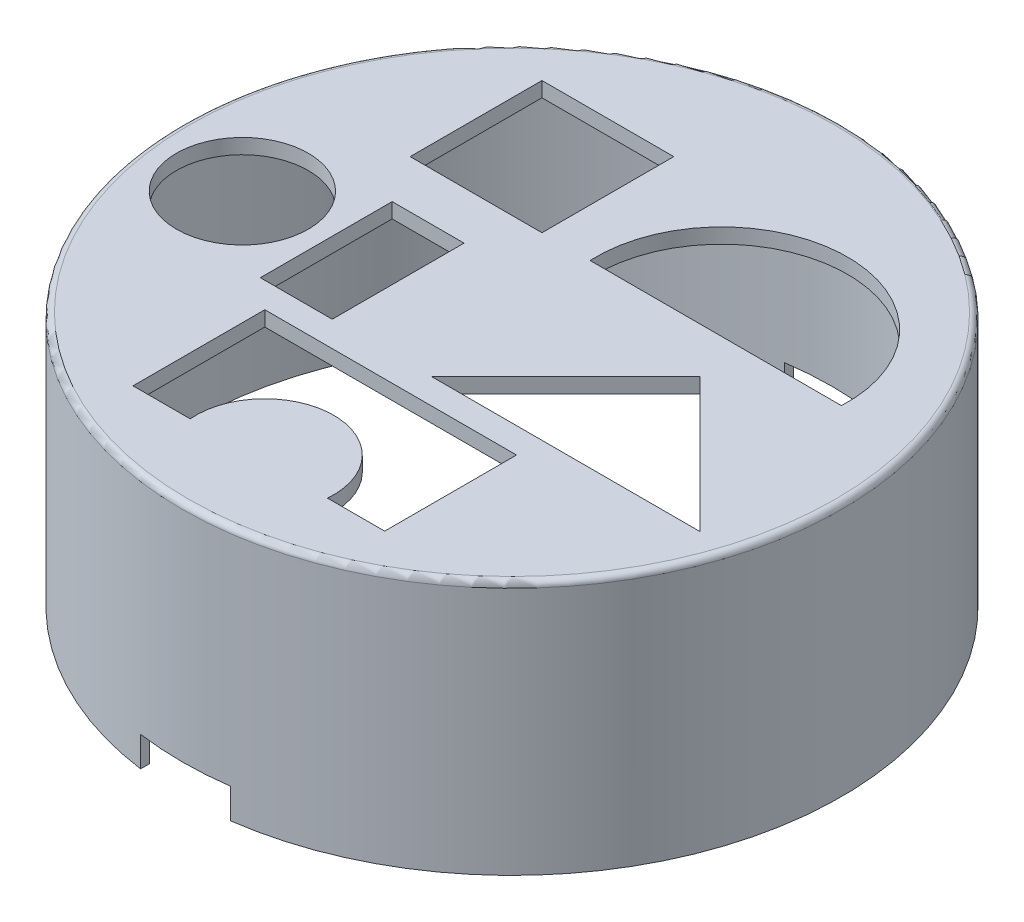
from build123d import *

# Parameters (mm, degrees)
SKETCH1_R               = 55
SKETCH1_R_2             = 10
SKETCH1_W               = 20
SKETCH1_H               = 20
SKETCH1_W_2             = 10
SKETCH1_W_3             = 40
BOSS_EXTRUDE1_DEPTH     = 2.5
BOSS_EXTRUDE2_START     = 40
SKETCH2_R               = 55
SKETCH2_R_2             = 53.5
BOSS_EXTRUDE2_DEPTH     = 40
CUT_EXTRUDE1_START      = -5
SKETCH3_W               = 22
SKETCH3_H               = 22
SKETCH3_W_2             = 20
SKETCH3_H_2             = 20
SKETCH3_W_3             = 12
SKETCH3_W_4             = 10
SKETCH3_R               = 11
SKETCH3_R_2             = 10
CUT_EXTRUDE1_DEPTH      = 5
FILLET1_R               = 1
FILLET2_R               = 1
CUT_EXTRUDE2_DEPTH      = 88.464278486
CUT_EXTRUDE2_DEPTH_BACK = 88.464278486
SKETCH4_W               = 15
SKETCH4_H               = 5


with BuildPart() as part:
    # Sketch1 → Boss-Extrude1 (new body)
    # profile 1 of 2: a face of its own
    with BuildSketch(Plane(origin=(0, 0, 0), x_dir=(1, 0, 0), z_dir=(0, 1, 0))):
        with Locations(Location((0, 0, 0), (0, 0, 270))):
            Circle(SKETCH1_R)
        with Locations(Location((-40, -5, 0), (0, 0, 270))):
            Circle(SKETCH1_R_2, mode=Mode.SUBTRACT)
        with Locations((-20, 25)):
            Rectangle(SKETCH1_W, SKETCH1_H, mode=Mode.SUBTRACT)
        with Locations((-20, -5)):
            Rectangle(SKETCH1_W_2, SKETCH1_H, mode=Mode.SUBTRACT)
        Polygon((5, -15), (25, 5), (45, -15), align=None, mode=Mode.SUBTRACT)
        with Locations((0, -31.25)):
            Rectangle(SKETCH1_W_3, SKETCH1_H, mode=Mode.SUBTRACT)
        with BuildLine():
            Line((0, 15), (40, 15))
            ThreePointArc((40, 15), (20, 35), (0, 15))
        make_face(mode=Mode.SUBTRACT)
    # profile 2 of 2: a face of its own
    with BuildSketch(Plane(origin=(0, 0, 0), x_dir=(1, 0, 0), z_dir=(0, 1, 0))):
        with BuildLine():
            ThreePointArc((12.5, -41.25), (0, -28.75), (-12.5, -41.25))
            Line((-12.5, -41.25), (12.5, -41.25))
        make_face()
    extrude(amount=BOSS_EXTRUDE1_DEPTH)

    # Sketch2 → Boss-Extrude2 (add)
    with BuildSketch(Plane.XZ.offset(BOSS_EXTRUDE2_START)):
        with Locations(Location((0, 0, 0), (0, 0, 270))):
            Circle(SKETCH2_R)
        with Locations(Location((0, 0, 0), (0, 0, 270))):
            Circle(SKETCH2_R_2, mode=Mode.SUBTRACT)
    extrude(amount=-BOSS_EXTRUDE2_DEPTH)

    # Sketch3 → Cut-Extrude1 (cut)
    # profile 1 of 6: a face of its own
    with BuildSketch(Plane(origin=(0, 2.5, 0), x_dir=(1, 0, 0), z_dir=(0, 1, 0)).offset(CUT_EXTRUDE1_START)):
        with Locations((-20, 25)):
            Rectangle(SKETCH3_W, SKETCH3_H)
        with Locations((-20, 25)):
            Rectangle(SKETCH3_W_2, SKETCH3_H_2, mode=Mode.SUBTRACT)
    # profile 2 of 6: a face of its own
    with BuildSketch(Plane(origin=(0, 2.5, 0), x_dir=(1, 0, 0), z_dir=(0, 1, 0)).offset(CUT_EXTRUDE1_START)):
        with BuildLine():
            ThreePointArc((40.976176963, 14), (20, 36), (-0.976176963, 14))
            Line((-0.976176963, 14), (40.976176963, 14))
        make_face()
        with BuildLine():
            Line((40, 15), (0, 15))
            ThreePointArc((0, 15), (20, 35), (40, 15))
        make_face(mode=Mode.SUBTRACT)
    # profile 3 of 6: a face of its own
    with BuildSketch(Plane(origin=(0, 2.5, 0), x_dir=(1, 0, 0), z_dir=(0, 1, 0)).offset(CUT_EXTRUDE1_START)):
        with Locations((-20, -5)):
            Rectangle(SKETCH3_W_3, SKETCH3_H)
        with Locations((-20, -5)):
            Rectangle(SKETCH3_W_4, SKETCH3_H_2, mode=Mode.SUBTRACT)
    # profile 4 of 6: a face of its own
    with BuildSketch(Plane(origin=(0, 2.5, 0), x_dir=(1, 0, 0), z_dir=(0, 1, 0)).offset(CUT_EXTRUDE1_START)):
        Polygon((47.414213562, -16), (25, 6.414213562), (2.585786438, -16), align=None)
        Polygon((5, -15), (25, 5), (45, -15), align=None, mode=Mode.SUBTRACT)
    # profile 5 of 6: a face of its own
    with BuildSketch(Plane(origin=(0, 2.5, 0), x_dir=(1, 0, 0), z_dir=(0, 1, 0)).offset(CUT_EXTRUDE1_START)):
        with BuildLine():
            Line((21, -42.25), (21, -20.25))
            Line((21, -20.25), (-21, -20.25))
            Line((-21, -20.25), (-21, -42.25))
            Line((-21, -42.25), (-11.456439237, -42.25))
            ThreePointArc((-11.456439237, -42.25), (0, -29.75), (11.456439237, -42.25))
            Line((11.456439237, -42.25), (21, -42.25))
        make_face()
        with BuildLine():
            Line((-20, -21.25), (20, -21.25))
            Line((20, -21.25), (20, -41.25))
            Line((20, -41.25), (12.5, -41.25))
            ThreePointArc((12.5, -41.25), (0, -28.75), (-12.5, -41.25))
            Line((-12.5, -41.25), (-20, -41.25))
            Line((-20, -41.25), (-20, -21.25))
        make_face(mode=Mode.SUBTRACT)
    # profile 6 of 6: a face of its own
    with BuildSketch(Plane(origin=(0, 2.5, 0), x_dir=(1, 0, 0), z_dir=(0, 1, 0)).offset(CUT_EXTRUDE1_START)):
        with Locations(Location((-40, -5, 0), (0, 0, 270))):
            Circle(SKETCH3_R)
        with Locations((-40, -5)):
            Circle(SKETCH3_R_2, mode=Mode.SUBTRACT)
    extrude(amount=CUT_EXTRUDE1_DEPTH, mode=Mode.SUBTRACT)

    # Fillet1
    fillet1_edges = [part.edges().sort_by_distance(p)[0] for p in [
        (0, 2.5, -55),
    ]]
    fillet(fillet1_edges, radius=FILLET1_R)

    # Fillet2
    fillet2_edges = [part.edges().sort_by_distance(p)[0] for p in [
        (0, 0, 53.5),
    ]]
    fillet(fillet2_edges, radius=FILLET2_R)

    # Sketch4 → Cut-Extrude2 (cut, two sides: drawn at the far end of the back side and taken through both)
    with BuildSketch(Plane.XY.offset(-CUT_EXTRUDE2_DEPTH_BACK)):
        with Locations((0, -37.5)):
            Rectangle(SKETCH4_W, SKETCH4_H)
    extrude(amount=CUT_EXTRUDE2_DEPTH + CUT_EXTRUDE2_DEPTH_BACK, mode=Mode.SUBTRACT)


solid = part.part
